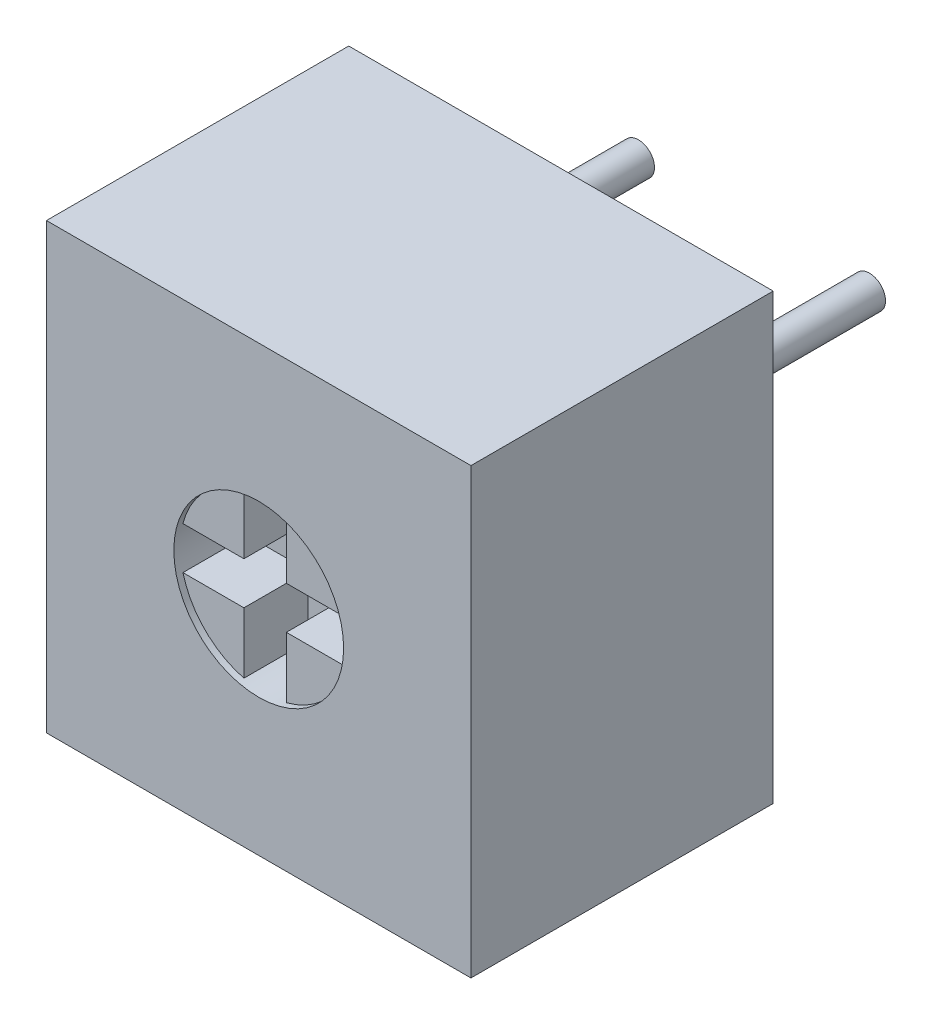
from build123d import *

# Parameters (mm, degrees)
SKETCH_1_W          = 6.6
SKETCH_1_H          = 6.9
EXTRUDE_1_DEPTH     = 4.7
SKETCH_2_R          = 1.32
CUT_EXTRUDE_1_DEPTH = 0.1
CUT_EXTRUDE_2_DEPTH = 1
SKETCH_4_R          = 0.25
EXTRUDE_2_DEPTH     = 3


with BuildPart() as part:
    # Эскиз1 → Бобышка-Вытянуть1 (new body)
    with BuildSketch(Plane.XY):
        Rectangle(SKETCH_1_W, SKETCH_1_H)
    extrude(amount=EXTRUDE_1_DEPTH)

    # Эскиз2 → Вырез-Вытянуть1 (cut)
    with BuildSketch(Plane.XY.offset(4.7)):
        Circle(SKETCH_2_R)
    extrude(amount=-CUT_EXTRUDE_1_DEPTH, mode=Mode.SUBTRACT)

    # Эскиз3 → Вырез-Вытянуть2 (cut)
    with BuildSketch(Plane.XY.offset(4.6)):
        with BuildLine():
            Line((-0.33, 1.278084504), (-0.33, 0.33))
            Line((-0.33, 0.33), (-1.278084504, 0.33))
            ThreePointArc((-1.278084504, 0.33), (-1.32, 0), (-1.278084504, -0.33))
            Line((-1.278084504, -0.33), (-0.33, -0.33))
            Line((-0.33, -0.33), (-0.33, -1.278084504))
            ThreePointArc((-0.33, -1.278084504), (0, -1.32), (0.33, -1.278084504))
            Line((0.33, -1.278084504), (0.33, -0.33))
            Line((0.33, -0.33), (1.278084504, -0.33))
            ThreePointArc((1.278084504, -0.33), (1.32, 0), (1.278084504, 0.33))
            Line((1.278084504, 0.33), (0.33, 0.33))
            Line((0.33, 0.33), (0.33, 1.278084504))
            ThreePointArc((0.33, 1.278084504), (0, 1.32), (-0.33, 1.278084504))
        make_face()
    extrude(amount=-CUT_EXTRUDE_2_DEPTH, mode=Mode.SUBTRACT)

    # Эскиз4 → Бобышка-Вытянуть2 (add)
    with BuildSketch(Plane.XY):
        with Locations((1.79605, 1.19)):
            Circle(SKETCH_4_R)
        with Locations((-1.79605, 1.19)):
            Circle(SKETCH_4_R)
        with Locations((0, -0.61)):
            Circle(SKETCH_4_R)
    extrude(amount=-EXTRUDE_2_DEPTH)


solid = part.part
